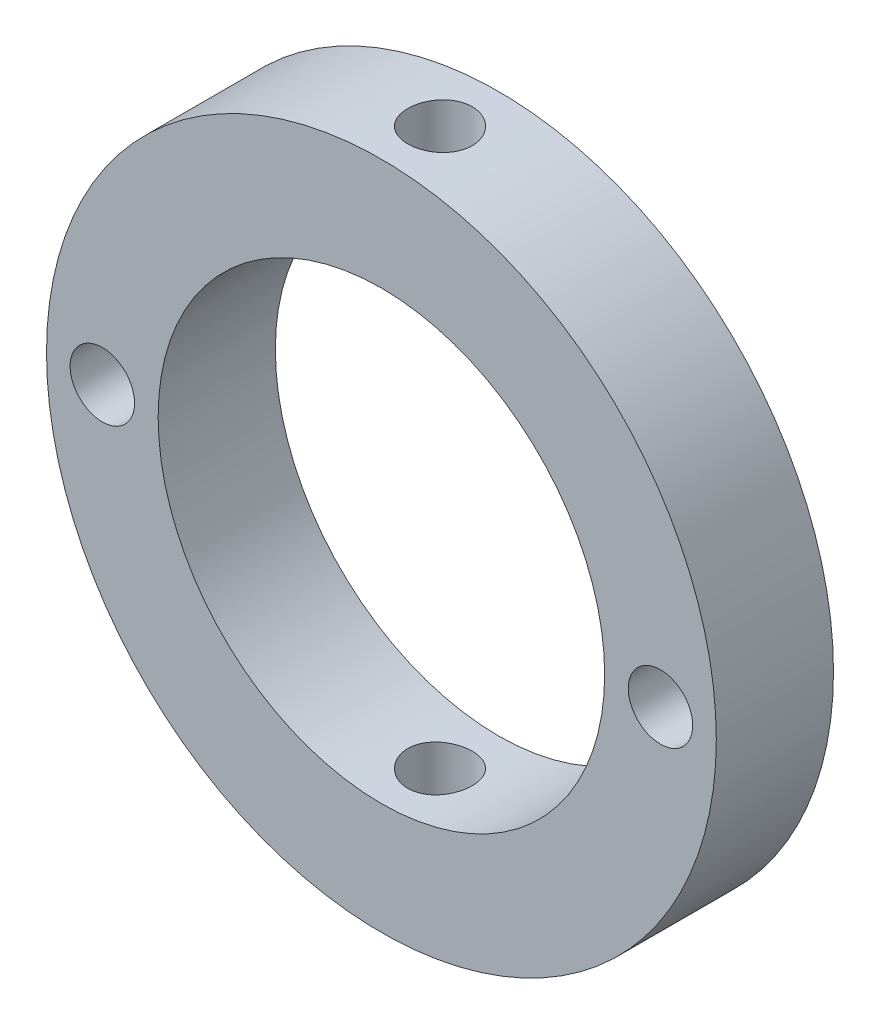
from build123d import *

# Parameters (mm, degrees)
SKETCH1_R           = 28.575
BOSS_EXTRUDE1_DEPTH = 10
SKETCH2_R           = 19.05
CUT_EXTRUDE1_DEPTH  = 42.630052246
SKETCH5_R           = 2.75
CUT_EXTRUDE2_DEPTH  = 65.673434461
SKETCH6_R           = 2.75
CUT_EXTRUDE3_DEPTH  = 42.630052408


with BuildPart() as part:
    # Sketch1 → Boss-Extrude1 (new body)
    with BuildSketch(Plane.XY):
        Circle(SKETCH1_R)
    extrude(amount=BOSS_EXTRUDE1_DEPTH)

    # Sketch2 → Cut-Extrude1 (cut, through all)
    with BuildSketch(Plane.XY.offset(10)):
        Circle(SKETCH2_R)
    extrude(amount=-CUT_EXTRUDE1_DEPTH, mode=Mode.SUBTRACT)

    # Sketch5 → Cut-Extrude2 (cut, through all)
    with BuildSketch(Plane(origin=(0, 28.575, 0), x_dir=(1, 0, 0), z_dir=(0, 1, 0))):
        with Locations(Location((0, -5, 0), (0, 0, 270))):
            Circle(SKETCH5_R)
    extrude(amount=-CUT_EXTRUDE2_DEPTH, mode=Mode.SUBTRACT)

    # Sketch6 → Cut-Extrude3 (cut, through all)
    with BuildSketch(Plane.XY.offset(10)):
        with Locations((-23.8125, 0)):
            Circle(SKETCH6_R)
        with Locations((23.8125, 0)):
            Circle(SKETCH6_R)
    extrude(amount=-CUT_EXTRUDE3_DEPTH, mode=Mode.SUBTRACT)


solid = part.part
